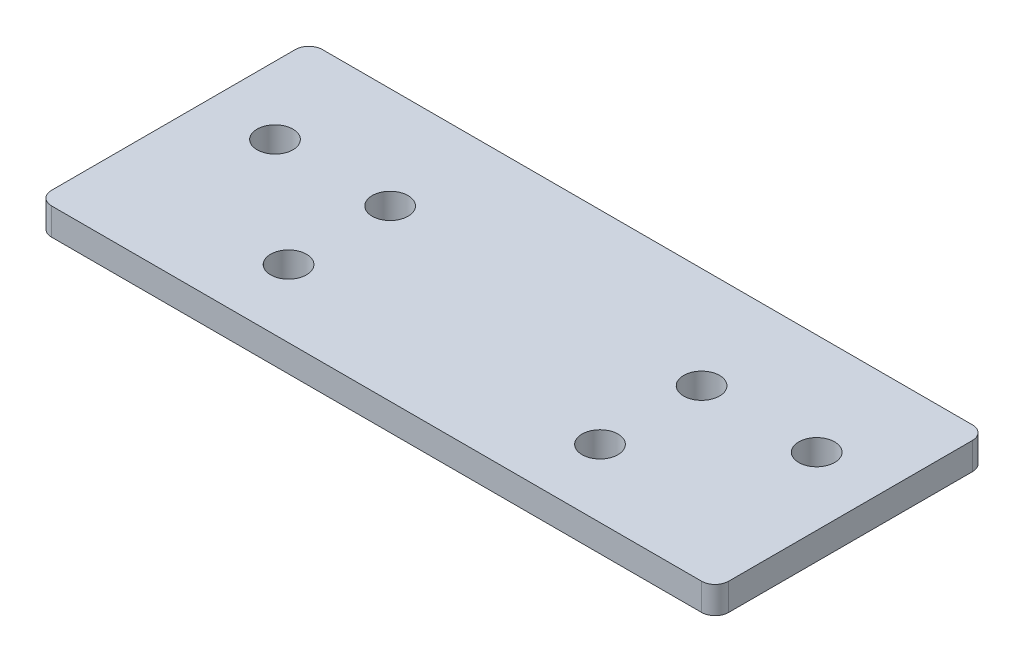
from build123d import *

# Parameters (mm, degrees)
SKETCH1_W                = 100
SKETCH1_H                = 40
BOSS_EXTRUDE1_DEPTH      = 4
FILLET1_R                = 2
M5_CLEARANCE_HOLE1_D     = 5.3
M5_CLEARANCE_HOLE1_DEPTH = 8
M5_CLEARANCE_HOLE1_TIP   = 1.59228064


with BuildPart() as part:
    # Sketch1 → Boss-Extrude1 (new body)
    with BuildSketch(Plane(origin=(0, 0, 0), x_dir=(1, 0, 0), z_dir=(0, 1, 0))):
        Rectangle(SKETCH1_W, SKETCH1_H)
    extrude(amount=BOSS_EXTRUDE1_DEPTH)

    # Fillet1
    fillet1_edges = [part.edges().sort_by_distance(p)[0] for p in [
        (-50, 2, -20),
        (50, 2, -20),
        (50, 2, 20),
        (-50, 2, 20),
    ]]
    fillet(fillet1_edges, radius=FILLET1_R)

    # M5 Clearance Hole1
    with Locations(Plane(origin=(0, 4, 0), x_dir=(1, 0, 0), z_dir=(0, 1, 0))):
        with Locations((-40, 5), (-23, 5), (-23, -10), (23, -10), (23, 5), (40, 5)):
            Hole(M5_CLEARANCE_HOLE1_D / 2, depth=M5_CLEARANCE_HOLE1_DEPTH)
            with Locations((0, 0, -(M5_CLEARANCE_HOLE1_DEPTH + M5_CLEARANCE_HOLE1_TIP / 2))):  # 118° drill point
                Cone(0, M5_CLEARANCE_HOLE1_D / 2, M5_CLEARANCE_HOLE1_TIP, mode=Mode.SUBTRACT)


solid = part.part
